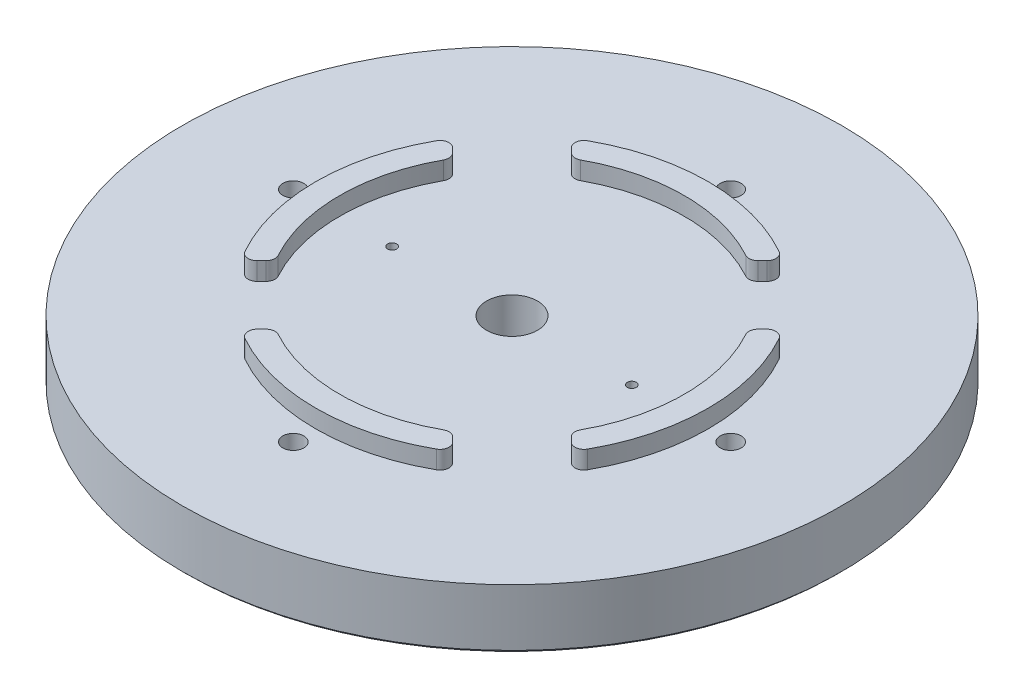
from build123d import *

# Parameters (mm, degrees)
SKETCH1_R           = 55
BOSS_EXTRUDE1_DEPTH = 10
SKETCH2_R           = 4.25
CUT_EXTRUDE1_DEPTH  = 79.421935707
SKETCH3_R           = 0.75
CUT_EXTRUDE2_DEPTH  = 79.421935707
SKETCH4_R           = 32.75
SKETCH4_R_2         = 28.75
BOSS_EXTRUDE2_DEPTH = 3
CUT_EXTRUDE3_DEPTH  = 3
FILLET1_R           = 1.5
SKETCH6_R           = 1.75
CUT_EXTRUDE4_DEPTH  = 79.421935707
SKETCH7_R           = 5.125
CUT_EXTRUDE5_DEPTH  = 5
CIRPATTERN1_COUNT   = 4
CHAMFER1_SIZE       = 0.5


with BuildPart() as part:
    # Sketch1 → Boss-Extrude1 (new body)
    with BuildSketch(Plane(origin=(0, 0, 0), x_dir=(1, 0, 0), z_dir=(0, 1, 0))):
        with Locations(Location((0, 0, 0), (0, 0, 270))):
            Circle(SKETCH1_R)
    extrude(amount=BOSS_EXTRUDE1_DEPTH)

    # Sketch2 → Cut-Extrude1 (cut, through all)
    with BuildSketch(Plane(origin=(0, 10, 0), x_dir=(1, 0, 0), z_dir=(0, 1, 0))):
        with Locations(Location((0, 0, 0), (0, 0, 270))):
            Circle(SKETCH2_R)
    extrude(amount=-CUT_EXTRUDE1_DEPTH, mode=Mode.SUBTRACT)

    # Sketch3 → Cut-Extrude2 (cut, through all)
    with BuildSketch(Plane(origin=(0, 10, 0), x_dir=(1, 0, 0), z_dir=(0, 1, 0))):
        with Locations(Location((-20, 0, 0), (0, 0, 270))):
            Circle(SKETCH3_R)
        with Locations(Location((20, 0, 0), (0, 0, 270))):
            Circle(SKETCH3_R)
    extrude(amount=-CUT_EXTRUDE2_DEPTH, mode=Mode.SUBTRACT)

    # Sketch4 → Boss-Extrude2 (add)
    with BuildSketch(Plane(origin=(0, 10, 0), x_dir=(1, 0, 0), z_dir=(0, 1, 0))):
        with Locations(Location((0, 0, 0), (0, 0, 270))):
            Circle(SKETCH4_R)
        with Locations(Location((0, 0, 0), (0, 0, 270))):
            Circle(SKETCH4_R_2, mode=Mode.SUBTRACT)
    extrude(amount=BOSS_EXTRUDE2_DEPTH)

    # Sketch5 → Cut-Extrude3 (cut)
    with BuildSketch(Plane(origin=(0, 13, 0), x_dir=(1, 0, 0), z_dir=(0, 1, 0))):
        Polygon((-36.203629602, 26.304134665), (-26.304134665, 36.203629602), (0, 9.899494937), (26.527588401, 36.427083337), (36.427083337, 26.527588401), (9.899494937, 0), (37.563449253, -27.663954316), (27.663954316, -37.563449253), (0, -9.899494937), (-22.89121747, -32.790712406), (-32.790712406, -22.89121747), (-9.899494937, 0), align=None)
    extrude(amount=-CUT_EXTRUDE3_DEPTH, mode=Mode.SUBTRACT)

    # Fillet1
    fillet1_edges = [part.edges().sort_by_distance(p)[0] for p in [
        (-24.667284079, 11.5, 14.767789143),
        (-14.767789143, 11.5, 24.667284079),
        (14.767789143, 11.5, 24.667284079),
        (24.667284079, 11.5, 14.767789143),
        (24.667284079, 11.5, -14.767789143),
        (14.767789143, 11.5, -24.667284079),
        (-14.767789143, 11.5, -24.667284079),
        (-24.667284079, 11.5, -14.767789143),
        (-27.572330212, 11.5, -17.672835275),
        (-17.672835275, 11.5, -27.572330212),
        (17.672835275, 11.5, -27.572330212),
        (27.572330212, 11.5, -17.672835275),
        (27.572330212, 11.5, 17.672835275),
        (17.672835275, 11.5, 27.572330212),
        (-17.672835275, 11.5, 27.572330212),
        (-27.572330212, 11.5, 17.672835275),
    ]]
    fillet(fillet1_edges, radius=FILLET1_R)

    # Sketch6 → Cut-Extrude4 (cut, through all)
    with BuildSketch(Plane(origin=(0, 10, 0), x_dir=(1, 0, 0), z_dir=(0, 1, 0))):
        with Locations(Location((36.5, 0, 0), (0, 0, 270))):
            Circle(SKETCH6_R)
    cut_extrude4 = extrude(amount=-CUT_EXTRUDE4_DEPTH, mode=Mode.SUBTRACT)

    # Sketch7 → Cut-Extrude5 (cut)
    with BuildSketch(Plane.XZ):
        with Locations(Location((36.5, 0, 0), (0, 0, 270))):
            Circle(SKETCH7_R)
    cut_extrude5 = extrude(amount=-CUT_EXTRUDE5_DEPTH, mode=Mode.SUBTRACT)

    # CirPattern1: Cut-Extrude4, Cut-Extrude5 ×4 about axis
    cirpattern1_axis = Axis((0, 0, 0), (0, 1, 0))
    add([cut_extrude4.rotate(cirpattern1_axis, i * 360 / CIRPATTERN1_COUNT) for i in range(1, CIRPATTERN1_COUNT)], mode=Mode.SUBTRACT)
    add([cut_extrude5.rotate(cirpattern1_axis, i * 360 / CIRPATTERN1_COUNT) for i in range(1, CIRPATTERN1_COUNT)], mode=Mode.SUBTRACT)

    # Chamfer1
    chamfer1_edges = [part.edges().sort_by_distance(p)[0] for p in [
        (0, 0, -55),
    ]]
    chamfer(chamfer1_edges, length=CHAMFER1_SIZE)


solid = part.part
